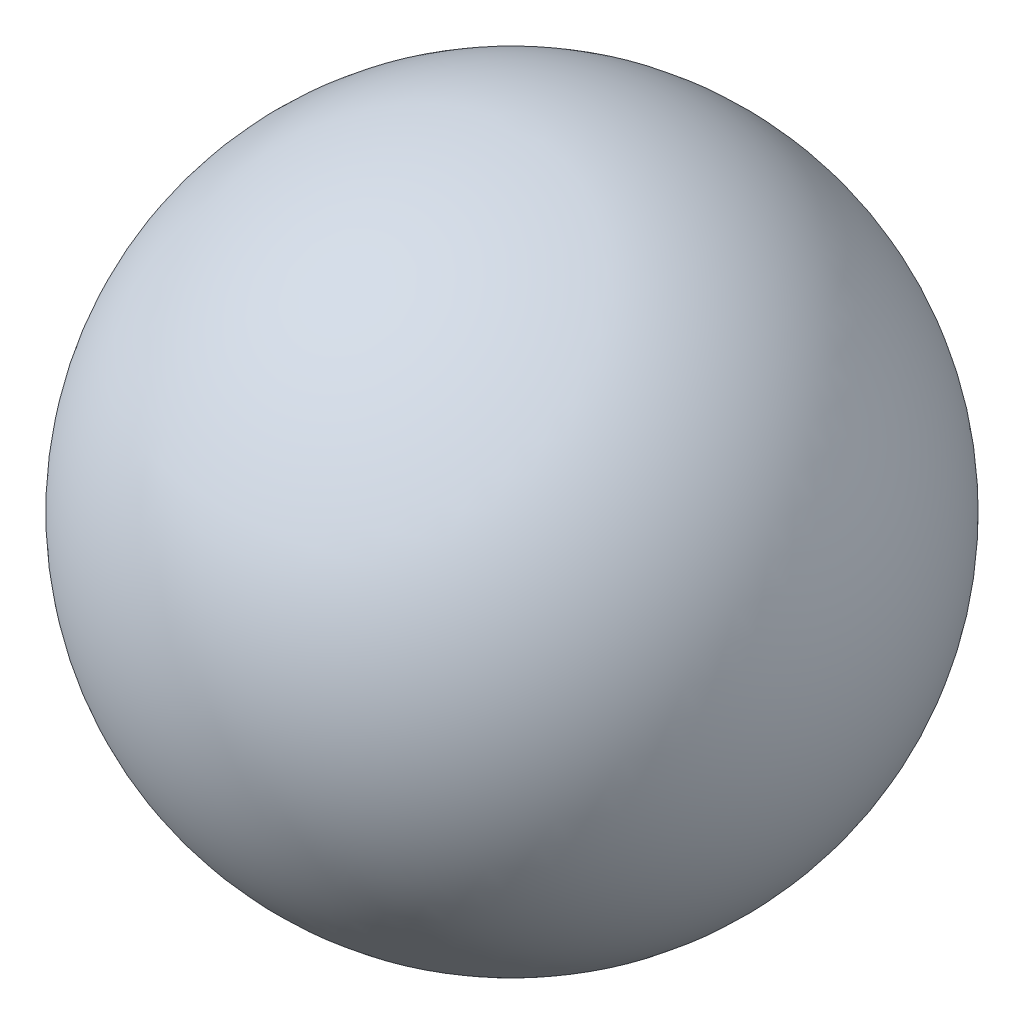
from build123d import *


with BuildPart() as part:
    # ｽｹｯﾁ1 → 回転1 (revolve)
    with BuildSketch(Plane.XY):
        with BuildLine():
            Line((0, 0), (0, 60))
            ThreePointArc((0, 60), (30, 30), (0, 0))
        make_face()
    revolve(axis=Axis((0, 0, 0), (0, 1, 0)))


solid = part.part
